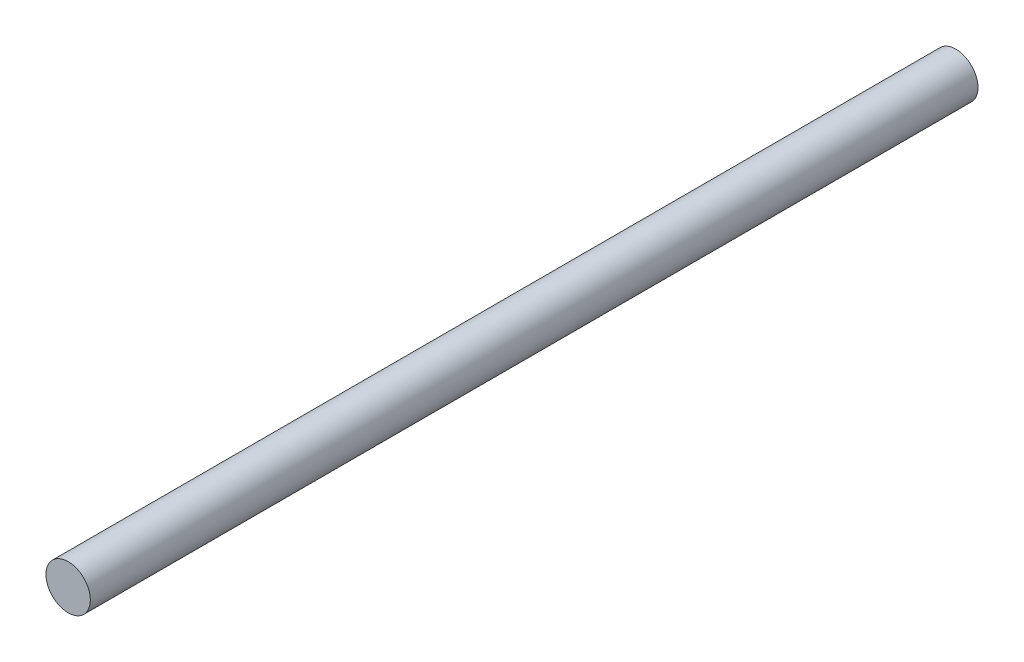
from build123d import *

# Parameters (mm, degrees)
BOSS_EXTRUDE1_DEPTH      = 127
BOSS_EXTRUDE1_DEPTH_BACK = 127
SKETCH1_R                = 6.35


with BuildPart() as part:
    # Sketch1 → Boss-Extrude1 (new, two sides: drawn at the far end of the back side and taken through both)
    with BuildSketch(Plane.XY.offset(-BOSS_EXTRUDE1_DEPTH_BACK)):
        Circle(SKETCH1_R)
    extrude(amount=BOSS_EXTRUDE1_DEPTH + BOSS_EXTRUDE1_DEPTH_BACK)


solid = part.part
